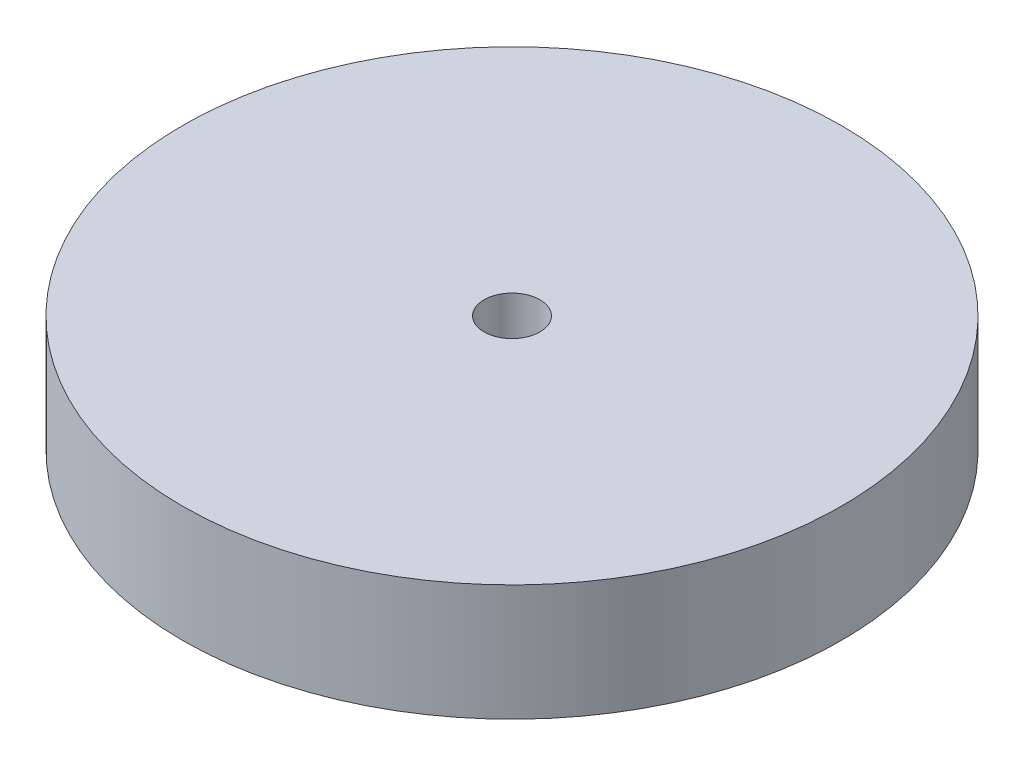
from build123d import *

# Parameters (mm, degrees)
SKETCH1_R           = 85
BOSS_EXTRUDE1_DEPTH = 30
SKETCH2_R           = 7.2
CUT_EXTRUDE1_DEPTH  = 120


with BuildPart() as part:
    # Sketch1 → Boss-Extrude1 (new body)
    with BuildSketch(Plane(origin=(0, 0, 0), x_dir=(1, 0, 0), z_dir=(0, 1, 0))):
        with Locations(Location((0, 0, 0), (0, 0, 270))):
            Circle(SKETCH1_R)
    extrude(amount=BOSS_EXTRUDE1_DEPTH)

    # Sketch2 → Cut-Extrude1 (cut)
    with BuildSketch(Plane(origin=(0, 30, 0), x_dir=(1, 0, 0), z_dir=(0, 1, 0))):
        with Locations(Location((0, 0, 0), (0, 0, 270))):
            Circle(SKETCH2_R)
    extrude(amount=-CUT_EXTRUDE1_DEPTH, mode=Mode.SUBTRACT)


solid = part.part
